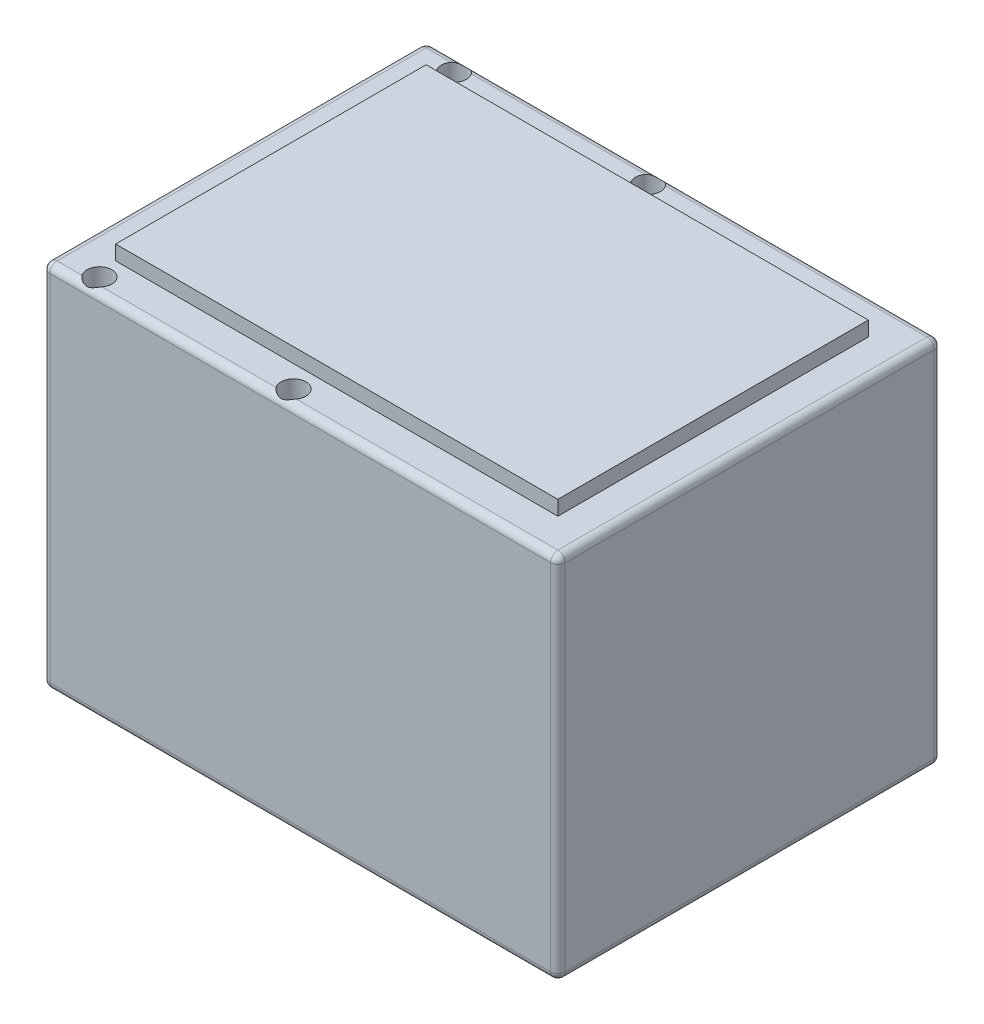
from build123d import *

# Parameters (mm, degrees)
EXTRUDE_START       = -6.25
SKETCH_1_W          = 35.2
SKETCH_1_H          = 25.2
EXTRUDE_1_DEPTH     = 13.1
EXTRUDE_5_DEPTH     = 4.4
SKETCH_16_R         = 1.3
CUT_EXTRUDE_7_DEPTH = 5.5
FILLET_2_R          = 0.5
SKETCH_17_W         = 30.2
SKETCH_17_H         = 21.2
EXTRUDE_6_DEPTH     = 1
SKETCH_18_W         = 30.2
SKETCH_18_H         = 21.2
EXTRUDE_7_DEPTH     = 1
SKETCH_19_R         = 0.85
CUT_EXTRUDE_8_DEPTH = 5
CUT_EXTRUDE_START   = -5
SKETCH_21_R         = 0.85
CUT_EXTRUDE_9_DEPTH = 5


with BuildPart() as part:
    # 草图1 → 凸台-拉伸1 (new, symmetric)
    with BuildSketch(Plane.XY.offset(6.25).offset(EXTRUDE_START)):
        with Locations((0, -0.411180124)):
            Rectangle(SKETCH_1_W, SKETCH_1_H)
    extrude(amount=EXTRUDE_1_DEPTH, both=True)

    # 草图15 → 凸台-拉伸5 (add)
    with BuildSketch(Plane.XZ.offset(13.011180124)):
        with BuildLine():
            Line((3.874456691, -2.060639983), (4.213205081, -1.865063509))
            Line((4.213205081, -1.865063509), (4.213205081, -2.256216457))
            ThreePointArc((4.213205081, -2.256216457), (4.333291419, -2.309698831), (4.456023033, -2.356794946))
            Line((4.456023033, -2.356794946), (4.732609934, -2.080208044))
            Line((4.732609934, -2.080208044), (4.833847767, -2.458032779))
            ThreePointArc((4.833847767, -2.458032779), (4.963684519, -2.478612153), (5.094423526, -2.492338228))
            Line((5.094423526, -2.492338228), (5.29, -2.153589838))
            Line((5.29, -2.153589838), (5.485576474, -2.492338228))
            ThreePointArc((5.485576474, -2.492338228), (5.616315481, -2.478612153), (5.746152233, -2.458032779))
            Line((5.746152233, -2.458032779), (5.847390066, -2.080208044))
            Line((5.847390066, -2.080208044), (6.123976967, -2.356794946))
            ThreePointArc((6.123976967, -2.356794946), (6.246708581, -2.309698831), (6.366794919, -2.256216457))
            Line((6.366794919, -2.256216457), (6.366794919, -1.865063509))
            Line((6.366794919, -1.865063509), (6.705543309, -2.060639983))
            ThreePointArc((6.705543309, -2.060639983), (6.811903573, -1.983383351), (6.914055811, -1.900642713))
            Line((6.914055811, -1.900642713), (6.812817979, -1.522817979))
            Line((6.812817979, -1.522817979), (7.190642713, -1.624055811))
            ThreePointArc((7.190642713, -1.624055811), (7.273383351, -1.521903573), (7.350639983, -1.415543309))
            Line((7.350639983, -1.415543309), (7.155063509, -1.076794919))
            Line((7.155063509, -1.076794919), (7.546216457, -1.076794919))
            ThreePointArc((7.546216457, -1.076794919), (7.599698831, -0.956708581), (7.646794946, -0.833976967))
            Line((7.646794946, -0.833976967), (7.370208044, -0.557390066))
            Line((7.370208044, -0.557390066), (7.748032779, -0.456152233))
            ThreePointArc((7.748032779, -0.456152233), (7.768612153, -0.326315481), (7.782338228, -0.195576474))
            Line((7.782338228, -0.195576474), (7.443589838, 0))
            Line((7.443589838, 0), (7.782338228, 0.195576474))
            ThreePointArc((7.782338228, 0.195576474), (7.768612153, 0.326315481), (7.748032779, 0.456152233))
            Line((7.748032779, 0.456152233), (7.370208044, 0.557390066))
            Line((7.370208044, 0.557390066), (7.646794946, 0.833976967))
            ThreePointArc((7.646794946, 0.833976967), (7.599698831, 0.956708581), (7.546216457, 1.076794919))
            Line((7.546216457, 1.076794919), (7.155063509, 1.076794919))
            Line((7.155063509, 1.076794919), (7.350639983, 1.415543309))
            ThreePointArc((7.350639983, 1.415543309), (7.273383351, 1.521903573), (7.190642713, 1.624055811))
            Line((7.190642713, 1.624055811), (6.812817979, 1.522817979))
            Line((6.812817979, 1.522817979), (6.914055811, 1.900642713))
            ThreePointArc((6.914055811, 1.900642713), (6.811903573, 1.983383351), (6.705543309, 2.060639983))
            Line((6.705543309, 2.060639983), (6.366794919, 1.865063509))
            Line((6.366794919, 1.865063509), (6.366794919, 2.256216457))
            ThreePointArc((6.366794919, 2.256216457), (6.246708581, 2.309698831), (6.123976967, 2.356794946))
            Line((6.123976967, 2.356794946), (5.847390066, 2.080208044))
            Line((5.847390066, 2.080208044), (5.746152233, 2.458032779))
            ThreePointArc((5.746152233, 2.458032779), (5.616315481, 2.478612153), (5.485576474, 2.492338228))
            Line((5.485576474, 2.492338228), (5.29, 2.153589838))
            Line((5.29, 2.153589838), (5.094423526, 2.492338228))
            ThreePointArc((5.094423526, 2.492338228), (4.963684519, 2.478612153), (4.833847767, 2.458032779))
            Line((4.833847767, 2.458032779), (4.732609934, 2.080208044))
            Line((4.732609934, 2.080208044), (4.456023033, 2.356794946))
            ThreePointArc((4.456023033, 2.356794946), (4.333291419, 2.309698831), (4.213205081, 2.256216457))
            Line((4.213205081, 2.256216457), (4.213205081, 1.865063509))
            Line((4.213205081, 1.865063509), (3.874456691, 2.060639983))
            ThreePointArc((3.874456691, 2.060639983), (3.768096427, 1.983383351), (3.665944189, 1.900642713))
            Line((3.665944189, 1.900642713), (3.767182021, 1.522817979))
            Line((3.767182021, 1.522817979), (3.389357287, 1.624055811))
            ThreePointArc((3.389357287, 1.624055811), (3.306616649, 1.521903573), (3.229360017, 1.415543309))
            Line((3.229360017, 1.415543309), (3.424936491, 1.076794919))
            Line((3.424936491, 1.076794919), (3.033783543, 1.076794919))
            ThreePointArc((3.033783543, 1.076794919), (2.980301169, 0.956708581), (2.933205054, 0.833976967))
            Line((2.933205054, 0.833976967), (3.209791956, 0.557390066))
            Line((3.209791956, 0.557390066), (2.831967221, 0.456152233))
            ThreePointArc((2.831967221, 0.456152233), (2.811387847, 0.326315481), (2.797661772, 0.195576474))
            Line((2.797661772, 0.195576474), (3.136410162, 0))
            Line((3.136410162, 0), (2.797661772, -0.195576474))
            ThreePointArc((2.797661772, -0.195576474), (2.811387847, -0.326315481), (2.831967221, -0.456152233))
            Line((2.831967221, -0.456152233), (3.209791956, -0.557390066))
            Line((3.209791956, -0.557390066), (2.933205054, -0.833976967))
            ThreePointArc((2.933205054, -0.833976967), (2.980301169, -0.956708581), (3.033783543, -1.076794919))
            Line((3.033783543, -1.076794919), (3.424936491, -1.076794919))
            Line((3.424936491, -1.076794919), (3.229360017, -1.415543309))
            ThreePointArc((3.229360017, -1.415543309), (3.306616649, -1.521903573), (3.389357287, -1.624055811))
            Line((3.389357287, -1.624055811), (3.767182021, -1.522817979))
            Line((3.767182021, -1.522817979), (3.665944189, -1.900642713))
            ThreePointArc((3.665944189, -1.900642713), (3.768096427, -1.983383351), (3.874456691, -2.060639983))
        make_face()
    extrude(amount=EXTRUDE_5_DEPTH)

    # 草图16 → 切除-拉伸7 (cut)
    with BuildSketch(Plane.XZ.offset(17.411180124)):
        with Locations(Location((5.29, 0, 0), (0, 0, 270))):
            Circle(SKETCH_16_R)
    extrude(amount=-CUT_EXTRUDE_7_DEPTH, mode=Mode.SUBTRACT)

    # 圆角2
    fillet_2_edges = [part.edges().sort_by_distance(p)[0] for p in [
        (0, 12.188819876, -13.1),
        (-17.6, -0.411180124, -13.1),
        (0, -13.011180124, -13.1),
        (-17.6, -0.411180124, 13.1),
        (0, 12.188819876, 13.1),
        (17.6, -0.411180124, 13.1),
        (0, -13.011180124, 13.1),
        (-17.6, -13.011180124, 0),
        (-17.6, 12.188819876, 0),
        (17.6, 12.188819876, 0),
        (17.6, -13.011180124, 0),
        (17.6, -0.411180124, -13.1),
    ]]
    fillet(fillet_2_edges, radius=FILLET_2_R)

    # 草图17 → 凸台-拉伸6 (add)
    with BuildSketch(Plane.XZ.offset(13.011180124)):
        Rectangle(SKETCH_17_W, SKETCH_17_H)
    extrude(amount=EXTRUDE_6_DEPTH)

    # 草图18 → 凸台-拉伸7 (add)
    with BuildSketch(Plane(origin=(0, 12.188819876, 0), x_dir=(1, 0, 0), z_dir=(0, 1, 0))):
        Rectangle(SKETCH_18_W, SKETCH_18_H)
    extrude(amount=EXTRUDE_7_DEPTH)

    # 草图19 → 切除-拉伸8 (cut)
    with BuildSketch(Plane.XZ.offset(13.011180124)):
        with Locations(Location((-1.45, 12.1, 0), (0, 0, 270))):
            Circle(SKETCH_19_R)
        with Locations(Location((-14.71, 12.1, 0), (0, 0, 270))):
            Circle(SKETCH_19_R)
        with Locations(Location((-1.45, -12.1, 0), (0, 0, 270))):
            Circle(SKETCH_19_R)
        with Locations(Location((-14.71, -12.1, 0), (0, 0, 270))):
            Circle(SKETCH_19_R)
    extrude(amount=-CUT_EXTRUDE_8_DEPTH, mode=Mode.SUBTRACT)

    # 草图21 → 切除-拉伸9 (cut)
    with BuildSketch(Plane(origin=(0, 12.188819876, 0), x_dir=(1, 0, 0), z_dir=(0, 1, 0)).offset(CUT_EXTRUDE_START)):
        with Locations(Location((-14.71, 12.1, 0), (0, 0, 90))):
            Circle(SKETCH_21_R)
        with Locations(Location((-1.45, 12.1, 0), (0, 0, 90))):
            Circle(SKETCH_21_R)
        with Locations(Location((-1.45, -12.1, 0), (0, 0, 90))):
            Circle(SKETCH_21_R)
        with Locations(Location((-14.71, -12.1, 0), (0, 0, 90))):
            Circle(SKETCH_21_R)
    extrude(amount=CUT_EXTRUDE_9_DEPTH, mode=Mode.SUBTRACT)


solid = part.part
